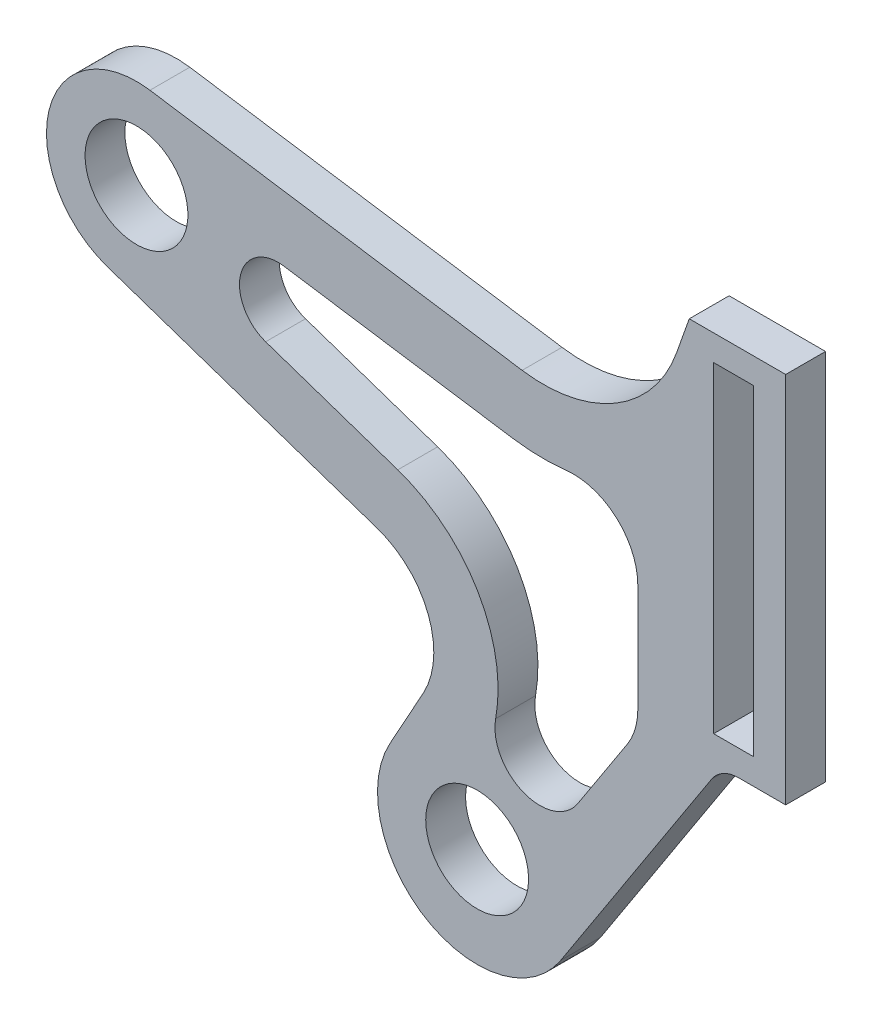
from build123d import *

# Parameters (mm, degrees)
SKETCH1_R           = 8
SKETCH1_W           = 6.2
SKETCH1_H           = 50
BOSS_EXTRUDE1_DEPTH = 6.2


with BuildPart() as part:
    # Sketch1 → Boss-Extrude1 (new body)
    with BuildSketch(Plane.XY):
        with BuildLine():
            Line((31.036127447, 82.458954329), (33, 88))
            Line((33, 88), (48, 88))
            Line((48, 88), (48, 30))
            Line((48, 30), (40.674945208, 30))
            ThreePointArc((40.674945208, 30), (38.288993634, 29.393999896), (36.481396821, 27.722894035))
            Line((36.481396821, 27.722894035), (13, -8.440971508))
            ThreePointArc((13, -8.440971508), (-7.975484523, -13.290660128), (-13.564659966, 7.5))
            Line((-13.564659966, 7.5), (-8.363522167, 16.906888758))
            ThreePointArc((-8.363522167, 16.906888758), (-7.61652309, 27.889035615), (-15.561762323, 35.507351095))
            Line((-15.561762323, 35.507351095), (-57.5, 49.742926416))
            ThreePointArc((-57.5, 49.742926416), (-66.602374097, 66.312916983), (-50.9, 76.841603953))
            Line((-50.9, 76.841603953), (7, 68.057217374))
            ThreePointArc((7, 68.057217374), (21.607393242, 70.936561685), (31.036127447, 82.458954329))
        make_face()
        with Locations(Location((-53, 63, 0), (0, 0, 180))):
            Circle(SKETCH1_R, mode=Mode.SUBTRACT)
        with Locations(Location((0, 0, 0), (0, 0, 180))):
            Circle(SKETCH1_R, mode=Mode.SUBTRACT)
        with Locations((39.9, 59)):
            Rectangle(SKETCH1_W, SKETCH1_H, mode=Mode.SUBTRACT)
        with BuildLine():
            Line((-30.073264159, 63.567409295), (5.5, 58.170357408))
            ThreePointArc((5.5, 58.170357408), (9.685179801, 57.814216157), (13.880952381, 58.009303341))
            ThreePointArc((13.880952381, 58.009303341), (21.663689812, 55.528335414), (25, 48.072113978))
            Line((25, 48.072113978), (25, 31.364873077))
            ThreePointArc((25, 31.364873077), (24.588299321, 28.525063906), (23.387096774, 25.919085008))
            Line((23.387096774, 25.919085008), (15.641533812, 13.990088635))
            ThreePointArc((15.641533812, 13.990088635), (7.184832002, 11.297220659), (2.884689445, 19.060990196))
            ThreePointArc((2.884689445, 19.060990196), (0.088285739, 34.851646077), (-12.347476609, 44.976689369))
            Line((-12.347476609, 44.976689369), (-32.901835588, 51.95369035))
            ThreePointArc((-32.901835588, 51.95369035), (-36.802853058, 59.055114879), (-30.073264159, 63.567409295))
        make_face(mode=Mode.SUBTRACT)
    extrude(amount=BOSS_EXTRUDE1_DEPTH)


solid = part.part
